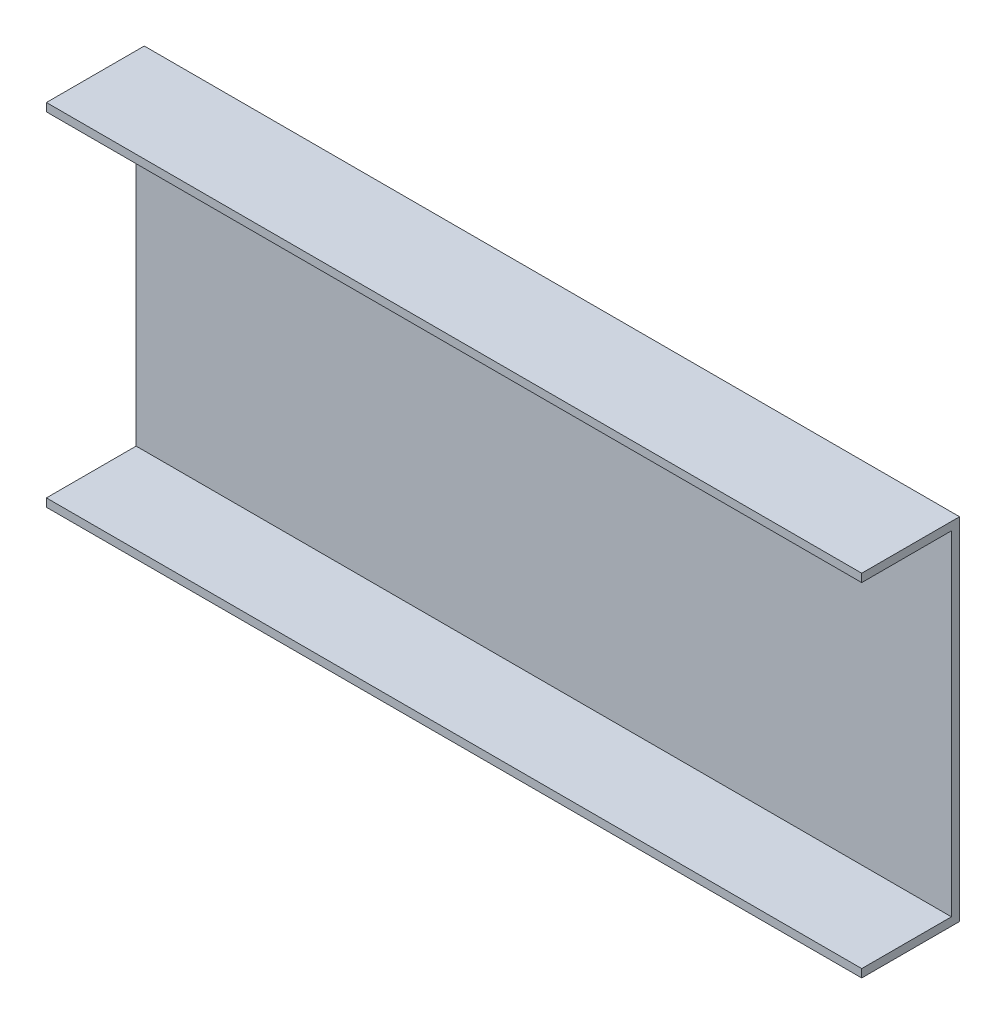
from build123d import *

# Parameters (mm, degrees)
SKETCH_1_W          = 100
SKETCH_1_H          = 43
EXTRUDE_1_DEPTH     = 12
SKETCH_2_W          = 100
SKETCH_2_H          = 41
CUT_EXTRUDE_1_DEPTH = 11


with BuildPart() as part:
    # 草图1 → 凸台-拉伸1 (new body)
    with BuildSketch(Plane.XY):
        with Locations((50, -21.5)):
            Rectangle(SKETCH_1_W, SKETCH_1_H)
    extrude(amount=EXTRUDE_1_DEPTH)

    # 草图2 → 切除-拉伸1 (cut)
    with BuildSketch(Plane.XY.offset(12)):
        with Locations((50, -21.5)):
            Rectangle(SKETCH_2_W, SKETCH_2_H)
    extrude(amount=-CUT_EXTRUDE_1_DEPTH, mode=Mode.SUBTRACT)


solid = part.part
